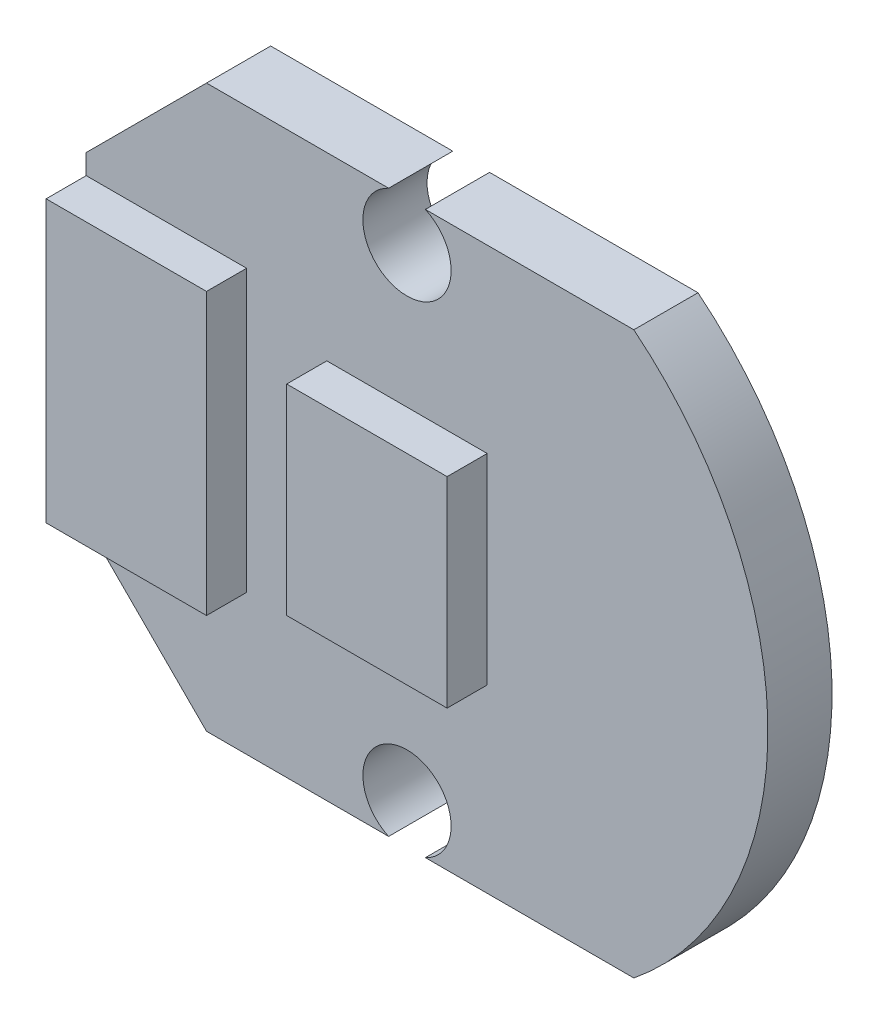
from build123d import *

# Parameters (mm, degrees)
SALIENTE_EXTRUIR1_DEPTH = 1.6
CROQUIS2_R              = 1.1
CORTAR_EXTRUIR2_DEPTH   = 12.513470372
CROQUIS3_W              = 4
CROQUIS3_H              = 5
CROQUIS3_H_2            = 7
SALIENTE_EXTRUIR2_DEPTH = 1


with BuildPart() as part:
    # Croquis1 → Saliente-Extruir1 (new body)
    with BuildSketch(Plane.XY):
        with BuildLine():
            Line((5.656854249, 7), (-5, 7))
            Line((-5, 7), (-8, 4))
            Line((-8, 4), (-8, -4))
            Line((-8, -4), (-5, -7))
            Line((-5, -7), (5.656854249, -7))
            ThreePointArc((5.656854249, -7), (9, 0), (5.656854249, 7))
        make_face()
    extrude(amount=SALIENTE_EXTRUIR1_DEPTH)

    # Croquis2 → Cortar-Extruir2 (cut, through all)
    with BuildSketch(Plane.XY.offset(1.6)):
        with Locations((0, 6)):
            Circle(CROQUIS2_R)
        with Locations((0, -6)):
            Circle(CROQUIS2_R)
    extrude(amount=-CORTAR_EXTRUIR2_DEPTH, mode=Mode.SUBTRACT)

    # Croquis3 → Saliente-Extruir2 (add)
    with BuildSketch(Plane.XY.offset(1.6)):
        Rectangle(CROQUIS3_W, CROQUIS3_H)
        with Locations((-6, 0)):
            Rectangle(CROQUIS3_W, CROQUIS3_H_2)
    extrude(amount=SALIENTE_EXTRUIR2_DEPTH)


solid = part.part
